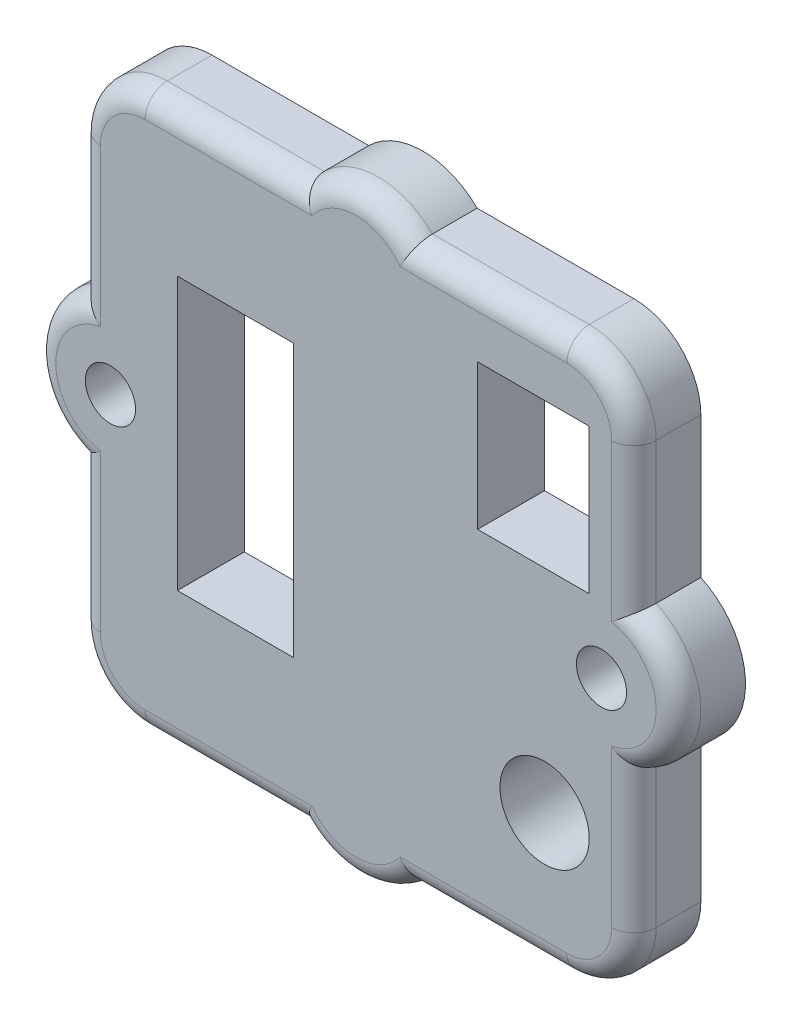
from build123d import *

# Parameters (mm, degrees)
SKETCH1_R           = 1.125
SKETCH1_R_2         = 2
SKETCH1_W           = 5.2
SKETCH1_H           = 12.2
SKETCH1_W_2         = 5
SKETCH1_H_2         = 6.5
BOSS_EXTRUDE1_DEPTH = 3
FILLET1_R           = 1


with BuildPart() as part:
    # Sketch1 → Boss-Extrude1 (new body)
    with BuildSketch(Plane.XY):
        with BuildLine():
            Line((23.501825189, 8.05), (23.501825189, 14.369504832))
            ThreePointArc((23.501825189, 14.369504832), (21.501825189, 17.5), (23.501825189, 20.630495168))
            Line((23.501825189, 20.630495168), (23.501825189, 26.95))
            ThreePointArc((23.501825189, 26.95), (24.380504846, 29.071320344), (26.501825189, 29.95))
            Line((26.501825189, 29.95), (33.522833629, 29.95))
            ThreePointArc((33.522833629, 29.95), (35.951825189, 30.95), (38.38081675, 29.95))
            Line((38.38081675, 29.95), (45.401825189, 29.95))
            ThreePointArc((45.401825189, 29.95), (47.523145533, 29.071320344), (48.401825189, 26.95))
            Line((48.401825189, 26.95), (48.401825189, 20.630495168))
            ThreePointArc((48.401825189, 20.630495168), (50.401825189, 17.5), (48.401825189, 14.369504832))
            Line((48.401825189, 14.369504832), (48.401825189, 8.05))
            ThreePointArc((48.401825189, 8.05), (47.523145533, 5.928679656), (45.401825189, 5.05))
            Line((45.401825189, 5.05), (38.38081675, 5.05))
            ThreePointArc((38.38081675, 5.05), (35.951825189, 4.05), (33.522833629, 5.05))
            Line((33.522833629, 5.05), (26.501825189, 5.05))
            ThreePointArc((26.501825189, 5.05), (24.380504846, 5.928679656), (23.501825189, 8.05))
        make_face()
        with Locations((24.951825189, 17.5)):
            Circle(SKETCH1_R, mode=Mode.SUBTRACT)
        with Locations((46.951825189, 17.5)):
            Circle(SKETCH1_R, mode=Mode.SUBTRACT)
        with Locations((44.401825189, 11)):
            Circle(SKETCH1_R_2, mode=Mode.SUBTRACT)
        with Locations((30.551825189, 17.5)):
            Rectangle(SKETCH1_W, SKETCH1_H, mode=Mode.SUBTRACT)
        with Locations((43.901825189, 23.75)):
            Rectangle(SKETCH1_W_2, SKETCH1_H_2, mode=Mode.SUBTRACT)
    extrude(amount=BOSS_EXTRUDE1_DEPTH)

    # Fillet1
    fillet1_edges = [part.edges().sort_by_distance(p)[0] for p in [
        (35.951825189, 4.05, 3),
        (41.891320969, 5.05, 3),
        (47.523145533, 5.928679656, 3),
        (48.401825189, 11.209752416, 3),
        (50.401825189, 17.5, 3),
        (48.401825189, 23.790247584, 3),
        (47.523145533, 29.071320344, 3),
        (41.891320969, 29.95, 3),
        (35.951825189, 30.95, 3),
        (30.012329409, 29.95, 3),
        (24.380504846, 5.928679656, 3),
        (24.380504846, 29.071320344, 3),
        (23.501825189, 23.790247584, 3),
        (21.501825189, 17.5, 3),
        (23.501825189, 11.209752416, 3),
        (30.012329409, 5.05, 3),
    ]]
    fillet(fillet1_edges, radius=FILLET1_R)


solid = part.part
